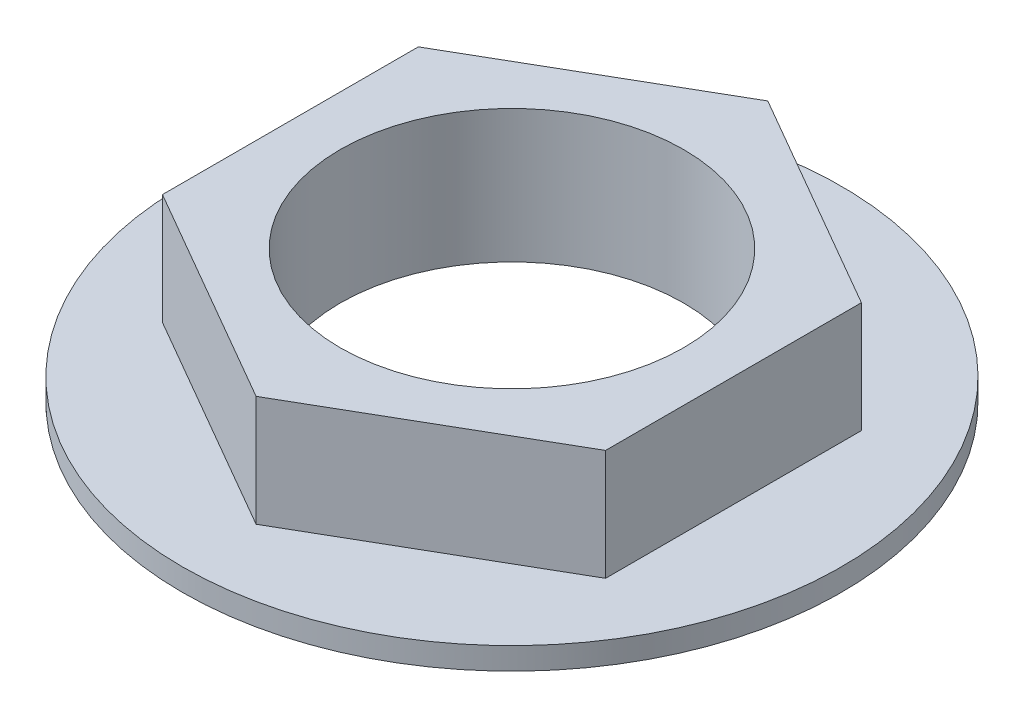
from build123d import *

# Parameters (mm, degrees)
SKETCH1_R           = 5.95
SKETCH1_R_2         = 3.1
BOSS_EXTRUDE1_DEPTH = 0.4
BOSS_EXTRUDE2_START = 2
SKETCH2_R           = 3.1
BOSS_EXTRUDE2_DEPTH = 2


with BuildPart() as part:
    # Sketch1 → Boss-Extrude1 (new body)
    with BuildSketch(Plane(origin=(0, 0, 0), x_dir=(1, 0, 0), z_dir=(0, 1, 0))):
        with Locations(Location((0, 0, 0), (0, 0, 270))):
            Circle(SKETCH1_R)
        with Locations(Location((0, 0, 0), (0, 0, 270))):
            Circle(SKETCH1_R_2, mode=Mode.SUBTRACT)
    extrude(amount=-BOSS_EXTRUDE1_DEPTH)

    # Sketch2 → Boss-Extrude2 (add)
    with BuildSketch(Plane(origin=(0, 0, 0), x_dir=(1, 0, 0), z_dir=(0, 1, 0)).offset(BOSS_EXTRUDE2_START)):
        Polygon((-4, -2.309401077), (0, -4.618802154), (4, -2.309401077), (4, 2.309401077), (0, 4.618802154), (-4, 2.309401077), align=None)
        with Locations(Location((0, 0, 0), (0, 0, 270))):
            Circle(SKETCH2_R, mode=Mode.SUBTRACT)
    extrude(amount=-BOSS_EXTRUDE2_DEPTH)


solid = part.part
